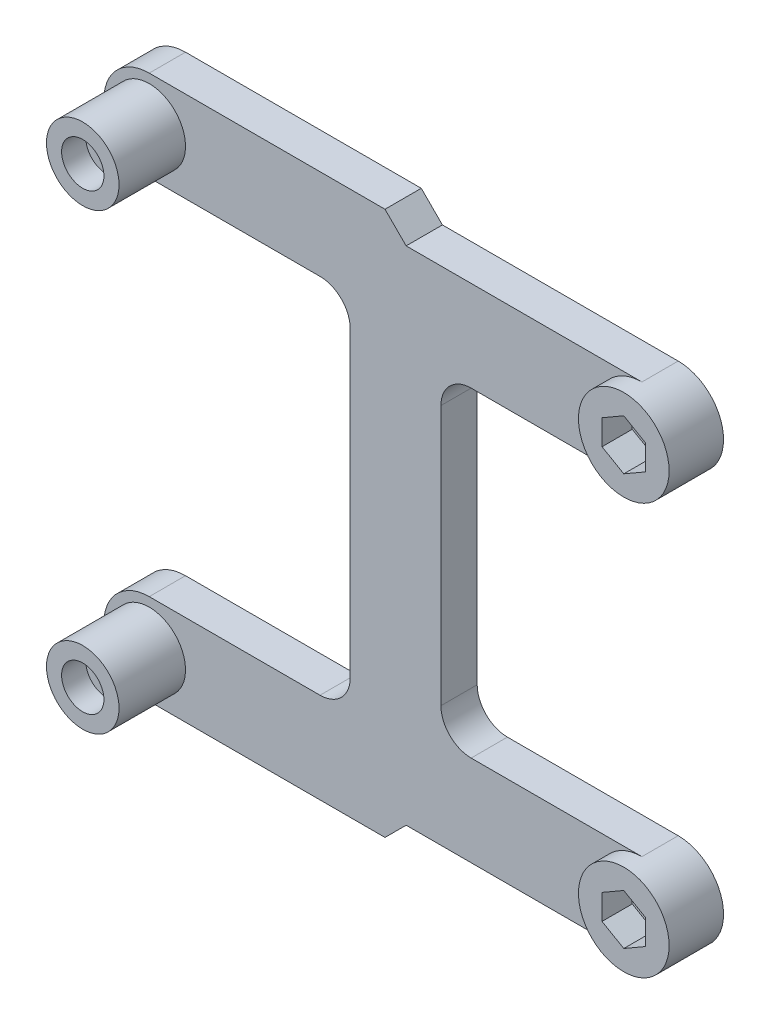
from build123d import *

# Parameters (mm, degrees)
SKETCH1_R           = 4.5
SKETCH1_R_2         = 2.15
BOSS_EXTRUDE1_DEPTH = 6
BOSS_EXTRUDE2_START = -1
SKETCH2_R           = 6
SKETCH2_R_2         = 3.5
BOSS_EXTRUDE2_DEPTH = 12
BOSS_EXTRUDE3_START = -5
SKETCH3_R           = 3.5
SKETCH3_R_2         = 1.65
BOSS_EXTRUDE3_DEPTH = 8
SKETCH4_R           = 7.5
SKETCH4_R_2         = 2.15
BOSS_EXTRUDE4_DEPTH = 3
CUT_EXTRUDE1_DEPTH  = 5


with BuildPart() as part:
    # Sketch1 → Boss-Extrude1 (new body)
    with BuildSketch(Plane.XY):
        with BuildLine():
            Line((0, 82.5), (39, 82.5))
            Line((39, 82.5), (42.5, 79))
            Line((42.5, 79), (81.5, 79))
            ThreePointArc((81.5, 79), (89, 71.5), (81.5, 64))
            Line((81.5, 64), (53.25, 64))
            ThreePointArc((53.25, 64), (49.714466094, 62.535533906), (48.25, 59))
            Line((48.25, 59), (48.25, 16))
            ThreePointArc((48.25, 16), (49.714466094, 12.464466094), (53.25, 11))
            Line((53.25, 11), (81.5, 11))
            ThreePointArc((81.5, 11), (89, 3.5), (81.5, -4))
            Line((81.5, -4), (42.5, -4))
            Line((42.5, -4), (39, -7.5))
            Line((39, -7.5), (0, -7.5))
            ThreePointArc((0, -7.5), (-7.5, 0), (0, 7.5))
            Line((0, 7.5), (28.25, 7.5))
            ThreePointArc((28.25, 7.5), (31.785533906, 8.964466094), (33.25, 12.5))
            Line((33.25, 12.5), (33.25, 62.5))
            ThreePointArc((33.25, 62.5), (31.785533906, 66.035533906), (28.25, 67.5))
            Line((28.25, 67.5), (0, 67.5))
            ThreePointArc((0, 67.5), (-7.5, 75), (0, 82.5))
        make_face()
        Circle(SKETCH1_R, mode=Mode.SUBTRACT)
        with Locations(Location((0, 75, 0), (0, 0, 180))):
            Circle(SKETCH1_R, mode=Mode.SUBTRACT)
        with Locations((81.5, 71.5)):
            Circle(SKETCH1_R_2, mode=Mode.SUBTRACT)
        with Locations((81.5, 3.5)):
            Circle(SKETCH1_R_2, mode=Mode.SUBTRACT)
    extrude(amount=BOSS_EXTRUDE1_DEPTH)

    # Sketch2 → Boss-Extrude2 (add)
    # profile 1 of 2: a face of its own
    with BuildSketch(Plane.XY.offset(6).offset(BOSS_EXTRUDE2_START)):
        with Locations(Location((0, 75, 0), (0, 0, 180))):
            Circle(SKETCH2_R)
        with Locations((0, 75)):
            Circle(SKETCH2_R_2, mode=Mode.SUBTRACT)
    # profile 2 of 2: a face of its own
    with BuildSketch(Plane.XY.offset(6).offset(BOSS_EXTRUDE2_START)):
        with Locations(Location((0, 0, 0), (0, 0, 180))):
            Circle(SKETCH2_R)
        Circle(SKETCH2_R_2, mode=Mode.SUBTRACT)
    extrude(amount=BOSS_EXTRUDE2_DEPTH)

    # Sketch3 → Boss-Extrude3 (add)
    # profile 1 of 2: a face of its own
    with BuildSketch(Plane(origin=(0, 0, 0), x_dir=(-1, 0, 0), z_dir=(0, 0, -1)).offset(BOSS_EXTRUDE3_START)):
        with Locations(Location((0, 75, 0), (0, 0, 180))):
            Circle(SKETCH3_R)
        with Locations((0, 75)):
            Circle(SKETCH3_R_2, mode=Mode.SUBTRACT)
    # profile 2 of 2: a face of its own
    with BuildSketch(Plane(origin=(0, 0, 0), x_dir=(-1, 0, 0), z_dir=(0, 0, -1)).offset(BOSS_EXTRUDE3_START)):
        with Locations(Location((0, 0, 0), (0, 0, 180))):
            Circle(SKETCH3_R)
        Circle(SKETCH3_R_2, mode=Mode.SUBTRACT)
    extrude(amount=-BOSS_EXTRUDE3_DEPTH)

    # Sketch4 → Boss-Extrude4 (add)
    # profile 1 of 2: a face of its own
    with BuildSketch(Plane.XY.offset(6)):
        with Locations(Location((81.5, 3.5, 0), (0, 0, 90))):
            Circle(SKETCH4_R)
        with Locations((81.5, 3.5)):
            Circle(SKETCH4_R_2, mode=Mode.SUBTRACT)
    # profile 2 of 2: a face of its own
    with BuildSketch(Plane.XY.offset(6)):
        with Locations(Location((81.5, 71.5, 0), (0, 0, 90))):
            Circle(SKETCH4_R)
        with Locations((81.5, 71.5)):
            Circle(SKETCH4_R_2, mode=Mode.SUBTRACT)
    extrude(amount=BOSS_EXTRUDE4_DEPTH)

    # Sketch5 → Cut-Extrude1 (cut)
    with BuildSketch(Plane.XY.offset(9)):
        Polygon((77.9, 5.578460969), (81.5, 7.656921938), (85.1, 5.578460969), (85.1, 1.421539031), (81.5, -0.656921938), (77.9, 1.421539031), align=None)
        Polygon((77.9, 73.578460969), (81.5, 75.656921938), (85.1, 73.578460969), (85.1, 69.421539031), (81.5, 67.343078062), (77.9, 69.421539031), align=None)
    extrude(amount=-CUT_EXTRUDE1_DEPTH, mode=Mode.SUBTRACT)


solid = part.part
